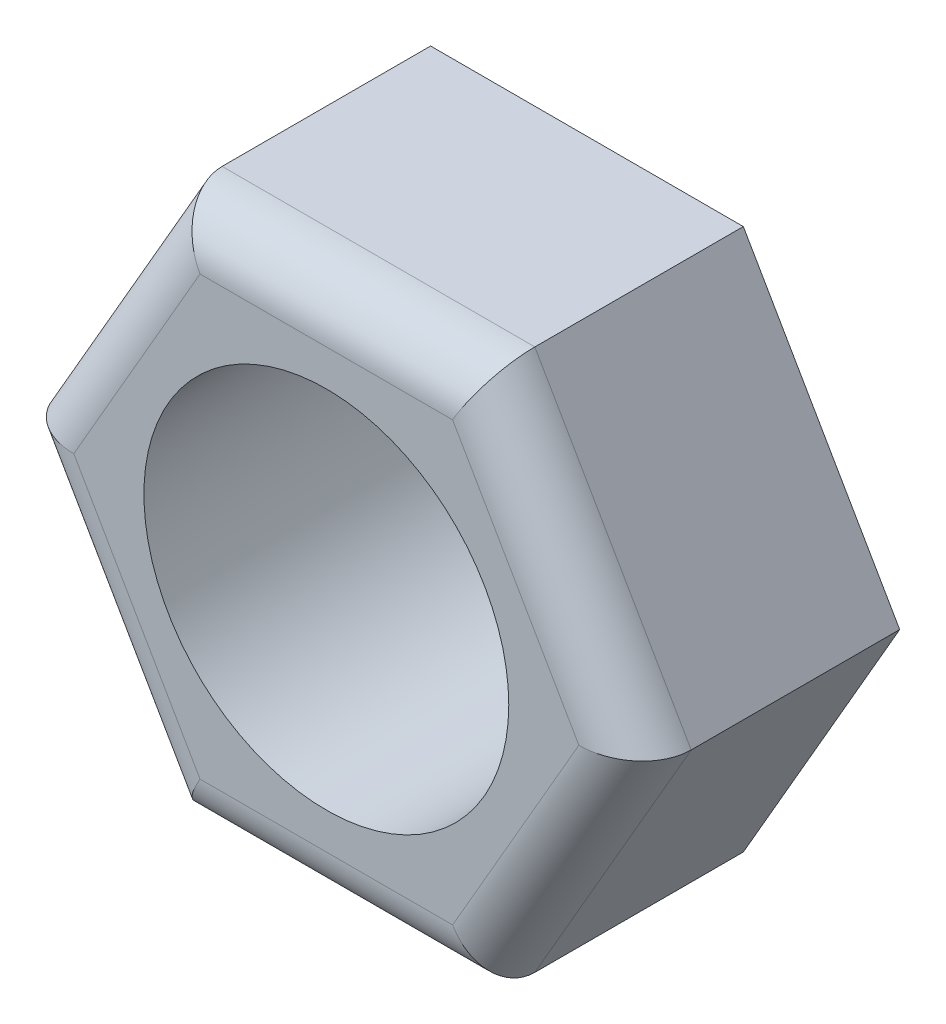
from build123d import *

# Parameters (mm, degrees)
SKETCH_1_R      = 1.75
EXTRUDE_1_DEPTH = 2.5
FILLET_1_R      = 0.5


with BuildPart() as part:
    # ｽｹｯﾁ1 → ﾎﾞｽ - 押し出し1 (new body)
    with BuildSketch(Plane.XY):
        Polygon((3, 0), (1.5, 2.598076211), (-1.5, 2.598076211), (-3, 0), (-1.5, -2.598076211), (1.5, -2.598076211), align=None)
        Circle(SKETCH_1_R, mode=Mode.SUBTRACT)
    extrude(amount=EXTRUDE_1_DEPTH)

    # ﾌｨﾚｯﾄ1
    fillet_1_edges = [part.edges().sort_by_distance(p)[0] for p in [
        (0, 2.598076211, 2.5),
        (-2.25, 1.299038106, 2.5),
        (-2.25, -1.299038106, 2.5),
        (0, -2.598076211, 2.5),
        (2.25, -1.299038106, 2.5),
        (2.25, 1.299038106, 2.5),
    ]]
    fillet(fillet_1_edges, radius=FILLET_1_R)


solid = part.part
